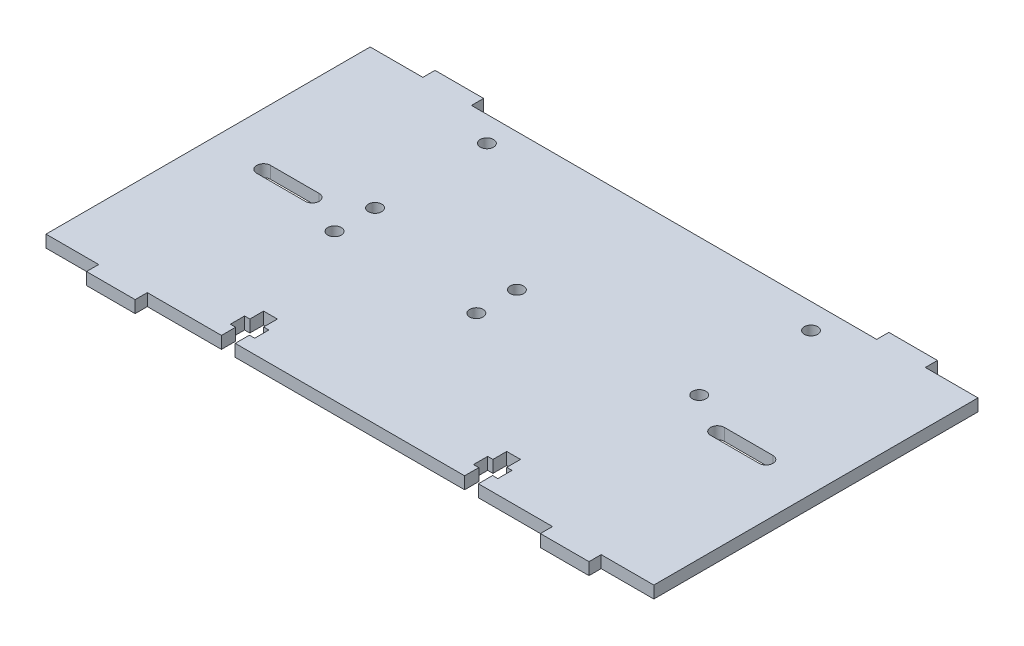
from build123d import *

# Parameters (mm, degrees)
SKETCH_1_R          = 1.65
EXTRUDE_1_DEPTH     = 3
CUT_EXTRUDE_1_DEPTH = 172.458449777


with BuildPart() as part:
    # 草图1 → 凸台-拉伸1 (new body)
    with BuildSketch(Plane(origin=(0, 0, 0), x_dir=(1, 0, 0), z_dir=(0, 1, 0))):
        Polygon((0, 0), (13, 0), (13, -3), (25, -3), (25, 0), (125, 0), (125, -3), (137, -3), (137, 0), (150, 0), (150, 80), (137, 80), (137, 83), (125, 83), (125, 80), (25, 80), (25, 83), (13, 83), (13, 80), (0, 80), align=None)
        with Locations(Location((35, 73.8, 0), (0, 0, 270))):
            Circle(SKETCH_1_R, mode=Mode.SUBTRACT)
        with Locations(Location((35, 46.2, 0), (0, 0, 270))):
            Circle(SKETCH_1_R, mode=Mode.SUBTRACT)
        with Locations(Location((115, 46.2, 0), (0, 0, 90))):
            Circle(SKETCH_1_R, mode=Mode.SUBTRACT)
        with Locations(Location((115, 73.8, 0), (0, 0, 90))):
            Circle(SKETCH_1_R, mode=Mode.SUBTRACT)
        with Locations(Location((35, 36.2, 0), (0, 0, 90))):
            Circle(SKETCH_1_R, mode=Mode.SUBTRACT)
        with Locations(Location((70, 46.2, 0), (0, 0, 90))):
            Circle(SKETCH_1_R, mode=Mode.SUBTRACT)
        with Locations(Location((70, 36.2, 0), (0, 0, 90))):
            Circle(SKETCH_1_R, mode=Mode.SUBTRACT)
        with BuildLine():
            Line((13, 42.4), (25, 42.4))
            ThreePointArc((25, 42.4), (26.7, 40.7), (25, 39))
            Line((25, 39), (13, 39))
            ThreePointArc((13, 39), (11.3, 40.7), (13, 42.4))
        make_face(mode=Mode.SUBTRACT)
        with BuildLine():
            Line((125, 42.4), (137, 42.4))
            ThreePointArc((137, 42.4), (138.7, 40.7), (137, 39))
            Line((137, 39), (125, 39))
            ThreePointArc((125, 39), (123.3, 40.7), (125, 42.4))
        make_face(mode=Mode.SUBTRACT)
    extrude(amount=EXTRUDE_1_DEPTH)

    # 草图2 → 切除-拉伸1 (cut, through all)
    with BuildSketch(Plane(origin=(0, 3, 0), x_dir=(1, 0, 0), z_dir=(0, 1, 0))):
        Polygon((43.3, 0), (43.3, 3.5), (42, 3.5), (42, 7), (43.3, 7), (43.3, 10.4), (46.7, 10.4), (46.7, 7), (48, 7), (48, 3.5), (46.7, 3.5), (46.7, 0), align=None)
        Polygon((103.3, 0), (106.7, 0), (106.7, 3.5), (108, 3.5), (108, 7), (106.7, 7), (106.7, 10.4), (103.3, 10.4), (103.3, 7), (102, 7), (102, 3.5), (103.3, 3.5), align=None)
    extrude(amount=-CUT_EXTRUDE_1_DEPTH, mode=Mode.SUBTRACT)


solid = part.part
